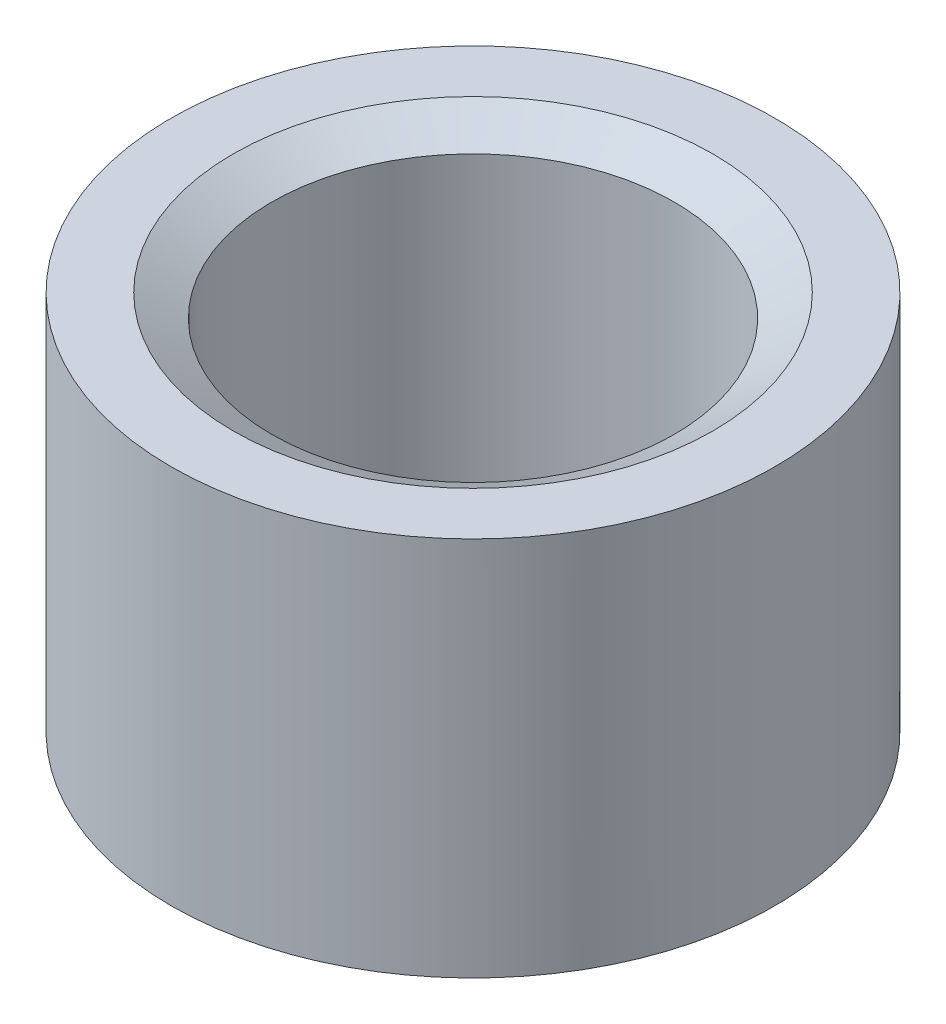
from build123d import *
from OCP.BRepFilletAPI import BRepFilletAPI_MakeChamfer

# Parameters (mm, degrees)
SKETCH1_W      = 0.79375
SKETCH1_H      = 3.175
CHAMFER1_SIZE  = 0.3048
CHAMFER1_SIZE2 = 0.175976362


with BuildPart() as part:
    # Sketch1 → Revolve1 (revolve)
    with BuildSketch(Plane(origin=(0, 0, 0), x_dir=(1, 0, 0), z_dir=(0, 0, -1)), mode=Mode.PRIVATE) as revolve1_sk:
        with Locations((1.984375, 1.5875)):
            Rectangle(SKETCH1_W, SKETCH1_H)
    revolve(revolve1_sk.sketch.rotate(Axis((0, 0, 0), (0, -1, 0)), 90), axis=Axis((0, 0, 0), (0, -1, 0)))

    # Chamfer1: one chamfer whose edges measure the first distance from different faces: ONE call of the kernel's chamfer builder (chamfer() names one face for all edges)
    chamfer1_edges_1 = [part.edges().sort_by_distance(p)[0] for p in [
        (0, 0, -1.5875),
    ]]
    chamfer1_side_1 = [part.faces().sort_by_distance(p)[0] for p in [
        (0, 0, -2.313898079),
    ]]
    chamfer1_edges_2 = [part.edges().sort_by_distance(p)[0] for p in [
        (0, -3.175, -2.38125),
    ]]
    chamfer1_side_2 = [part.faces().sort_by_distance(p)[0] for p in [
        (0, -3.175, -1.654851921),
    ]]
    chamfer1 = BRepFilletAPI_MakeChamfer(part.part.solid().wrapped)
    for e in chamfer1_edges_1:
        chamfer1.Add(CHAMFER1_SIZE, CHAMFER1_SIZE2, e.wrapped, chamfer1_side_1[0].wrapped)  # the first distance lies on this face
    for e in chamfer1_edges_2:
        chamfer1.Add(CHAMFER1_SIZE, CHAMFER1_SIZE2, e.wrapped, chamfer1_side_2[0].wrapped)  # the first distance lies on this face
    add(Compound.cast(chamfer1.Shape()), mode=Mode.REPLACE)


solid = part.part
